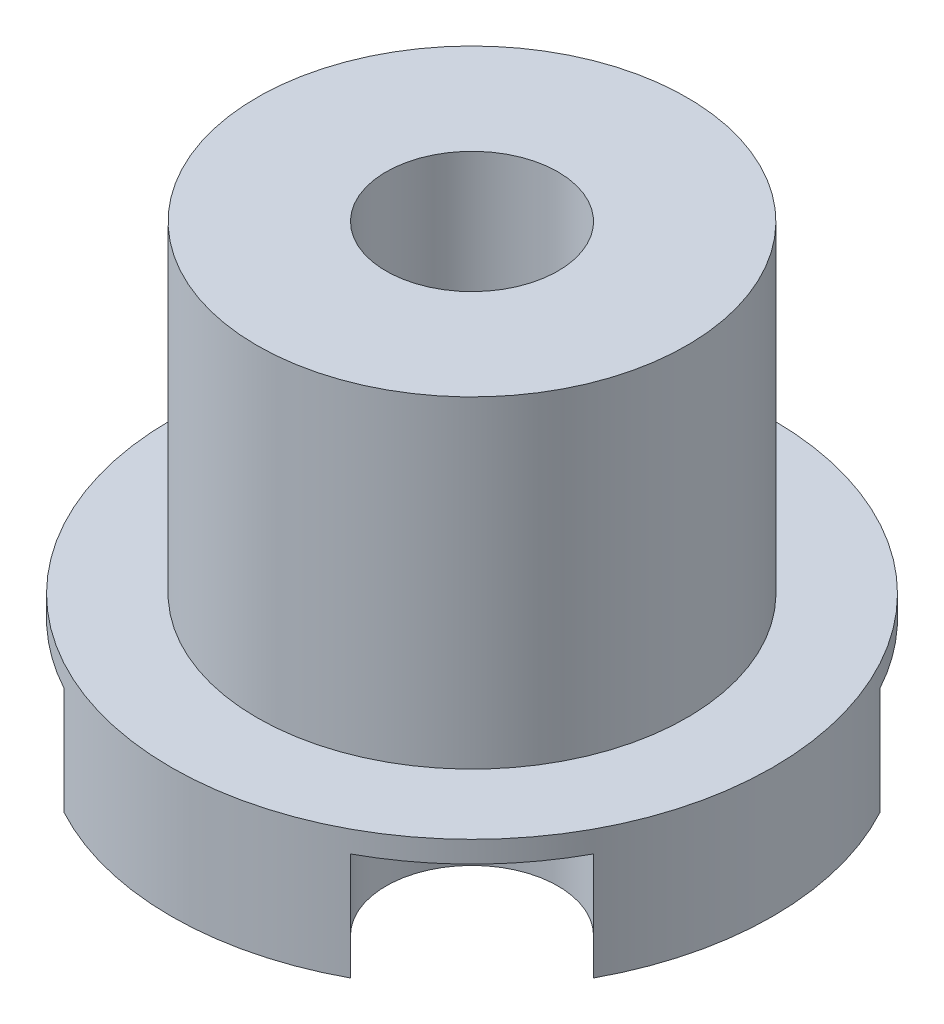
from build123d import *

# Parameters (mm, degrees)
SKETCH_1_R               = 14
EXTRUDE_1_DEPTH          = 6
SKETCH_2_R               = 10
EXTRUDE_2_DEPTH          = 15
SKETCH_3_R               = 1
SKETCH_3_R_2             = 4
CUT_EXTRUDE_1_DEPTH      = 5
CUT_EXTRUDE_2_DEPTH      = 5
PATTERN_CIRCULAR_1_COUNT = 4
SKETCH_5_R               = 4
CUT_EXTRUDE_3_DEPTH      = 29.861739379


with BuildPart() as part:
    # Эскиз1 → Бобышка-Вытянуть1 (new body)
    with BuildSketch(Plane(origin=(0, 0, 0), x_dir=(1, 0, 0), z_dir=(0, 1, 0))):
        with Locations(Location((0, 0, 0), (0, 0, 270))):
            Circle(SKETCH_1_R)
    extrude(amount=EXTRUDE_1_DEPTH)

    # Эскиз2 → Бобышка-Вытянуть2 (add)
    with BuildSketch(Plane(origin=(0, 6, 0), x_dir=(1, 0, 0), z_dir=(0, 1, 0))):
        with Locations(Location((0, 0, 0), (0, 0, 270))):
            Circle(SKETCH_2_R)
    extrude(amount=EXTRUDE_2_DEPTH)

    # Эскиз3 → Вырез-Вытянуть1 (cut)
    with BuildSketch(Plane.XZ):
        with Locations(Location((-8, 0, 0), (0, 0, 270))):
            Circle(SKETCH_3_R)
        with Locations(Location((8, 0, 0), (0, 0, 270))):
            Circle(SKETCH_3_R)
        with Locations(Location((0, 9.5, 0), (0, 0, 270))):
            Circle(SKETCH_3_R)
        with Locations(Location((0, -9.5, 0), (0, 0, 270))):
            Circle(SKETCH_3_R)
        with Locations((-7.778174593, 7.778174593)):
            Circle(SKETCH_3_R_2)
        with Locations((7.778174593, 7.778174593)):
            Circle(SKETCH_3_R_2)
        with Locations((7.778174593, -7.778174593)):
            Circle(SKETCH_3_R_2)
        with Locations((-7.778174593, -7.778174593)):
            Circle(SKETCH_3_R_2)
    extrude(amount=-CUT_EXTRUDE_1_DEPTH, mode=Mode.SUBTRACT)

    # Эскиз4 → Вырез-Вытянуть2 (cut)
    with BuildSketch(Plane.XZ):
        Polygon((-4.949747468, 10.606601718), (-10.606601718, 4.949747468), (-15.333238313, 9.676384064), (-9.676384064, 15.333238313), align=None)
    cut_extrude_2 = extrude(amount=-CUT_EXTRUDE_2_DEPTH, mode=Mode.SUBTRACT)

    # Круговой массив1: Вырез-Вытянуть2 ×4 about axis
    pattern_circular_1_axis = Axis((0, 0, 0), (0, 1, 0))
    for i in range(1, PATTERN_CIRCULAR_1_COUNT):
        add(cut_extrude_2.rotate(pattern_circular_1_axis, i * 360 / PATTERN_CIRCULAR_1_COUNT), mode=Mode.SUBTRACT)

    # Эскиз5 → Вырез-Вытянуть3 (cut, through all)
    with BuildSketch(Plane.XZ):
        with Locations(Location((0, 0, 0), (0, 0, 270))):
            Circle(SKETCH_5_R)
    extrude(amount=-CUT_EXTRUDE_3_DEPTH, mode=Mode.SUBTRACT)


solid = part.part
